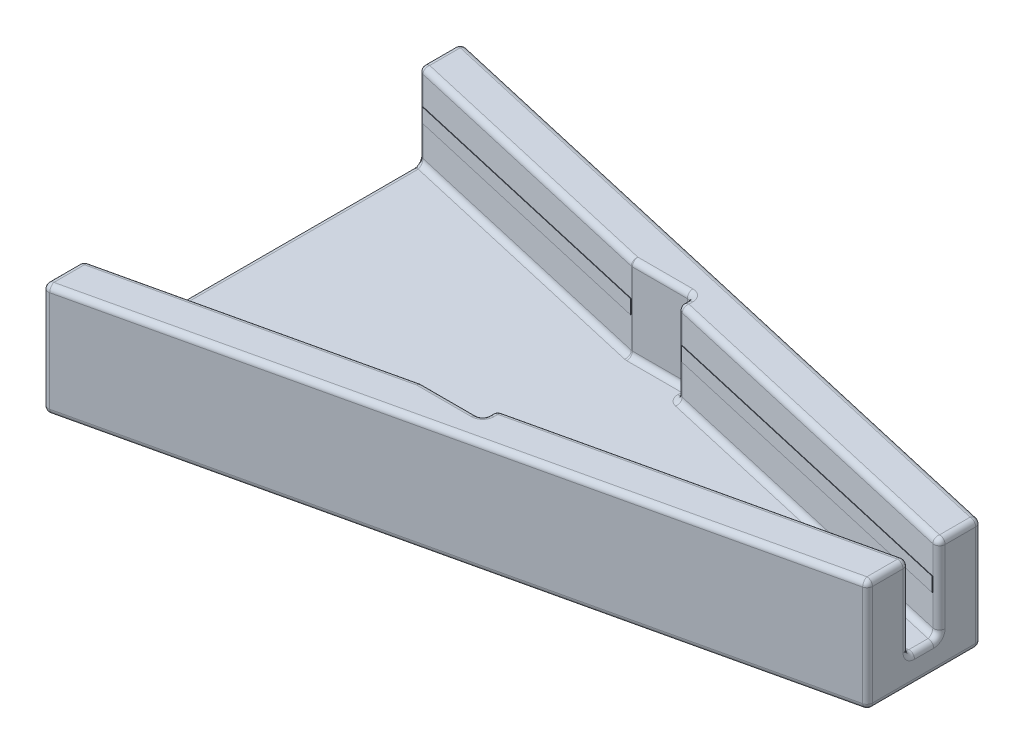
from build123d import *

# Parameters (mm, degrees)
BOSS_EXTRUDE1_DEPTH = 12.7
BOSS_EXTRUDE2_DEPTH = 38.1
SKETCH3_W           = 48.711101319
SKETCH3_H           = 95.25
CUT_EXTRUDE1_DEPTH  = 38.1
FILLET1_R           = 2.54
BOSS_EXTRUDE3_DEPTH = 6.35


with BuildPart() as part:
    # Sketch1 → Boss-Extrude1 (new body)
    with BuildSketch(Plane(origin=(0, 0, 0), x_dir=(1, 0, 0), z_dir=(0, 1, 0))):
        Polygon((0, 95.25), (0, -95.25), (304.8, -25.4), (304.8, 25.4), align=None)
    extrude(amount=BOSS_EXTRUDE1_DEPTH)

    # Sketch2 → Boss-Extrude2 (add)
    with BuildSketch(Plane(origin=(0, 12.7, 0), x_dir=(1, 0, 0), z_dir=(0, 1, 0))):
        Polygon((0, 76.2), (304.8, 6.35), (304.8, 25.4), (0, 95.25), align=None)
        Polygon((304.8, -6.35), (0, -76.2), (0, -95.25), (304.8, -25.4), align=None)
    extrude(amount=BOSS_EXTRUDE2_DEPTH)

    # Sketch3 → Cut-Extrude1 (cut)
    with BuildSketch(Plane(origin=(0, 50.8, 0), x_dir=(1, 0, 0), z_dir=(0, 1, 0))):
        with Locations((128.044449341, 0)):
            Rectangle(SKETCH3_W, SKETCH3_H)
    extrude(amount=-CUT_EXTRUDE1_DEPTH, mode=Mode.SUBTRACT)

    # Fillet1
    fillet1_edges = [part.edges().sort_by_distance(p)[0] for p in [
        (304.8, 12.7, 0),
        (228.6, 12.7, 23.8125),
        (304.8, 31.75, 6.35),
        (0, 31.75, 76.2),
        (304.8, 50.8, 15.875),
        (228.6, 50.8, 23.8125),
        (0, 50.8, 85.725),
        (152.4, 50.8, 60.325),
        (0, 12.7, 0),
        (62.345454545, 12.7, -61.9125),
        (0, 31.75, -76.2),
        (304.8, 31.75, -6.35),
        (0, 50.8, -85.725),
        (62.345454545, 50.8, -61.9125),
        (304.8, 50.8, -15.875),
        (152.4, 50.8, -60.325),
        (228.6, 50.8, -23.8125),
        (152.4, 50.8, -44.45),
        (228.6, 12.7, -23.8125),
        (62.345454545, 50.8, 61.9125),
        (62.345454545, 12.7, 61.9125),
        (124.690909091, 31.75, 47.625),
        (152.4, 31.75, 47.625),
        (138.545454545, 50.8, 47.625),
        (152.4, 50.8, 44.45),
        (138.545454545, 50.8, -47.625),
        (152.4, 12.7, 44.45),
        (138.545454545, 12.7, 47.625),
        (138.545454545, 12.7, -47.625),
        (152.4, 12.7, -44.45),
        (152.4, 31.75, 41.275),
        (152.4, 31.75, -41.275),
        (152.4, 31.75, -47.625),
        (124.690909091, 31.75, -47.625),
        (304.8, 0, 0),
        (152.4, 0, 60.325),
        (0, 0, 0),
        (152.4, 0, -60.325),
        (304.8, 25.4, -25.4),
        (304.8, 25.4, 25.4),
        (0, 25.4, 95.25),
        (0, 25.4, -95.25),
    ]]
    fillet(fillet1_edges, radius=FILLET1_R)

    # Sketch4 → Boss-Extrude3 (add)
    with BuildSketch(Plane(origin=(0, 35.56, 0), x_dir=(1, 0, 0), z_dir=(0, 1, 0))):
        Polygon((301.692624563, -7.062106871), (154.372624563, -40.822940204), (154.372624563, -40.562355842), (301.635887019, -6.814524862), align=None)
        Polygon((124.410851298, -47.689179911), (1.972624563, -75.747940204), (1.972624563, -75.487355842), (124.354113754, -47.441597902), align=None)
        Polygon((154.372624563, 40.822940204), (301.692624563, 7.062106871), (301.635887019, 6.814524862), (154.315887019, 40.575358195), align=None)
        Polygon((1.972624563, 75.747940204), (124.410851298, 47.689179911), (124.354113754, 47.441597902), (1.915887019, 75.500358195), align=None)
    extrude(amount=-BOSS_EXTRUDE3_DEPTH)


solid = part.part
